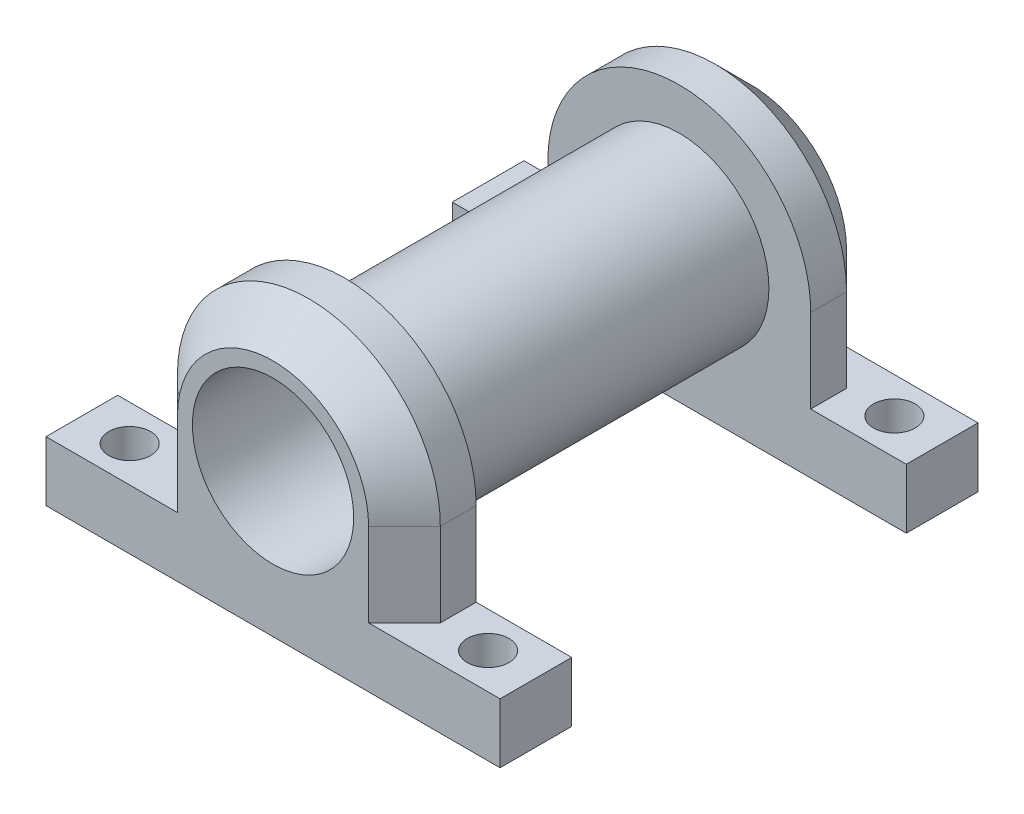
from build123d import *

# Parameters (mm, degrees)
BOSS_EXTRUDE1_DEPTH = 6
SKETCH2_R           = 7.5
BOSS_EXTRUDE2_DEPTH = 28
BOSS_EXTRUDE3_DEPTH = 6
SKETCH4_R           = 6.75
CUT_EXTRUDE1_DEPTH  = 46.880278988
SKETCH6_R           = 1.75
CUT_EXTRUDE3_DEPTH  = 48.801673611
CHAMFER1_SIZE       = 3


with BuildPart() as part:
    # Sketch1 → Boss-Extrude1 (new body)
    with BuildSketch(Plane.XY):
        with BuildLine():
            Line((-11, 0), (-11, -7))
            Line((-11, -7), (-19, -7))
            Line((-19, -7), (-19, -12))
            Line((-19, -12), (-11, -12))
            Line((-11, -12), (11, -12))
            Line((11, -12), (19, -12))
            Line((19, -12), (19, -7))
            Line((19, -7), (11, -7))
            Line((11, -7), (11, 0))
            ThreePointArc((11, 0), (0, 11), (-11, 0))
        make_face()
    extrude(amount=BOSS_EXTRUDE1_DEPTH)

    # Sketch2 → Boss-Extrude2 (add)
    with BuildSketch(Plane.XY.offset(6)):
        Circle(SKETCH2_R)
    extrude(amount=BOSS_EXTRUDE2_DEPTH)

    # Sketch3 → Boss-Extrude3 (add)
    with BuildSketch(Plane.XY.offset(34)):
        with BuildLine():
            Line((-11, 0), (-11, -7))
            Line((-11, -7), (-19, -7))
            Line((-19, -7), (-19, -12))
            Line((-19, -12), (19, -12))
            Line((19, -12), (19, -7))
            Line((19, -7), (11, -7))
            Line((11, -7), (11, 0))
            ThreePointArc((11, 0), (0, 11), (-11, 0))
        make_face()
    extrude(amount=BOSS_EXTRUDE3_DEPTH)

    # Sketch4 → Cut-Extrude1 (cut, through all)
    with BuildSketch(Plane.XY.offset(40)):
        Circle(SKETCH4_R)
    extrude(amount=-CUT_EXTRUDE1_DEPTH, mode=Mode.SUBTRACT)

    # Sketch6 → Cut-Extrude3 (cut, through all)
    with BuildSketch(Plane(origin=(0, -7, 0), x_dir=(1, 0, 0), z_dir=(0, 1, 0))):
        with Locations(Location((-15, -3, 0), (0, 0, 270))):
            Circle(SKETCH6_R)
        with Locations(Location((15, -3, 0), (0, 0, 270))):
            Circle(SKETCH6_R)
        with Locations(Location((15, -37, 0), (0, 0, 270))):
            Circle(SKETCH6_R)
        with Locations(Location((-15, -37, 0), (0, 0, 270))):
            Circle(SKETCH6_R)
    extrude(amount=-CUT_EXTRUDE3_DEPTH, mode=Mode.SUBTRACT)

    # Chamfer1
    chamfer1_edges = [part.edges().sort_by_distance(p)[0] for p in [
        (-11, -3.5, 0),
        (0, 11, 0),
        (11, -3.5, 0),
        (11, -3.5, 40),
        (0, 11, 40),
        (-11, -3.5, 40),
    ]]
    chamfer(chamfer1_edges, length=CHAMFER1_SIZE)


solid = part.part
